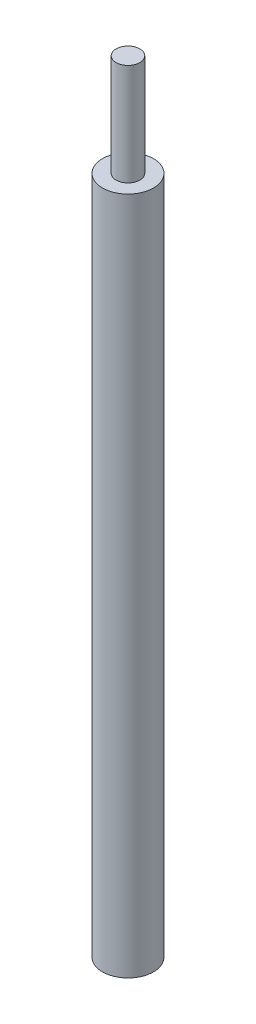
from build123d import *

# Parameters (mm, degrees)
SKETCH1_R           = 1.5
BOSS_EXTRUDE1_DEPTH = 40
SKETCH2_R           = 0.7
BOSS_EXTRUDE2_DEPTH = 6


with BuildPart() as part:
    # Sketch1 → Boss-Extrude1 (new body)
    with BuildSketch(Plane(origin=(0, 0, 0), x_dir=(1, 0, 0), z_dir=(0, 1, 0))):
        with Locations(Location((0, 0, 0), (0, 0, 270))):
            Circle(SKETCH1_R)
    extrude(amount=BOSS_EXTRUDE1_DEPTH)

    # Sketch2 → Boss-Extrude2 (add)
    with BuildSketch(Plane(origin=(0, 40, 0), x_dir=(1, 0, 0), z_dir=(0, 1, 0))):
        with Locations(Location((0, 0, 0), (0, 0, 270))):
            Circle(SKETCH2_R)
    extrude(amount=BOSS_EXTRUDE2_DEPTH)


solid = part.part
